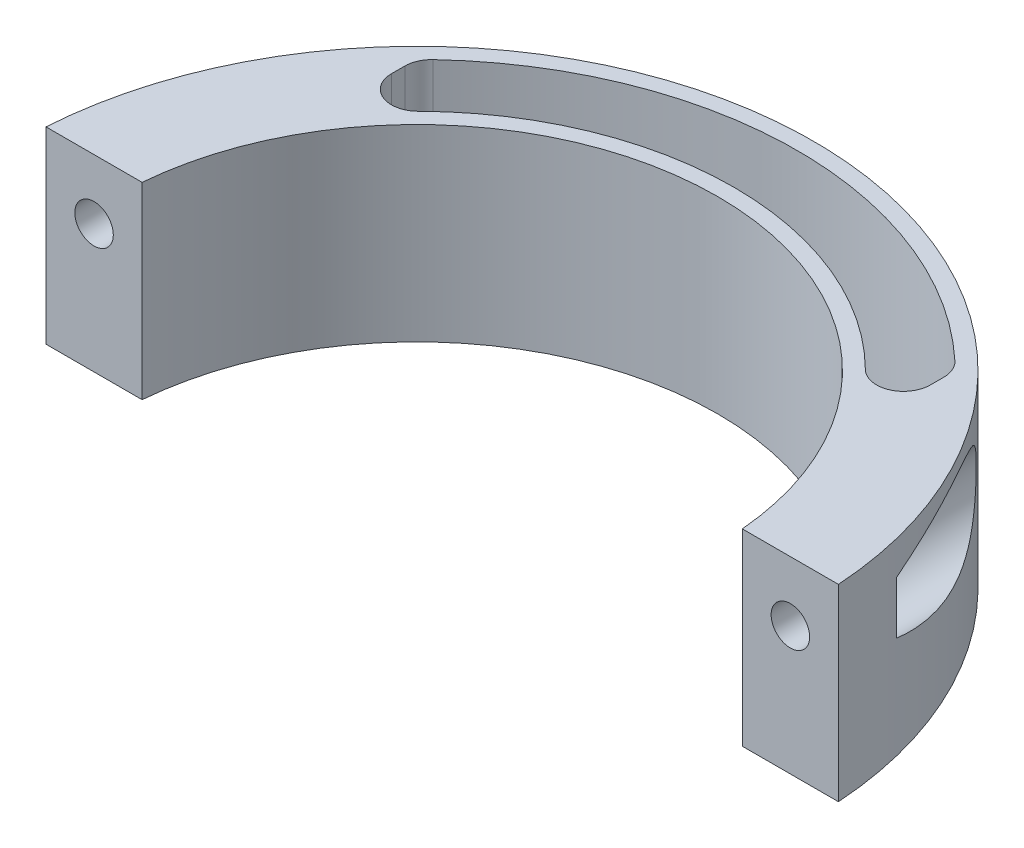
from build123d import *
from build123d.topology import SkipClean

# Parameters (mm, degrees)
SKETCH1_R               = 73.66
SKETCH1_R_2             = 55.88
BOSS_EXTRUDE1_DEPTH     = 22.225
CUT_EXTRUDE1_REACH      = 108.515
SKETCH3_W               = 174.179431321
SKETCH3_H               = 95.128766337
F_1_4_CLEARANCE_HOLE1_D = 7.14248
SKETCH5_R               = 8.5
CUT_EXTRUDE2_DEPTH      = 56.1975
BOSS_EXTRUDE3_START     = 12.7
BOSS_EXTRUDE3_DEPTH     = 12.7
CUT_EXTRUDE3_DEPTH      = 31.925
FILLET1_R               = 5


with BuildPart() as part:
    # Sketch1 → Boss-Extrude1 (new body)
    with BuildSketch(Plane(origin=(0, 0, 0), x_dir=(1, 0, 0), z_dir=(0, 1, 0))):
        with Locations(Location((0, 0, 0), (0, 0, 270))):
            Circle(SKETCH1_R)
        with Locations(Location((0, 0, 0), (0, 0, 270))):
            Circle(SKETCH1_R_2, mode=Mode.SUBTRACT)
    extrude(amount=BOSS_EXTRUDE1_DEPTH)

    # Sketch3 → Cut-Extrude1 (cut, up to next)
    with BuildSketch(Plane(origin=(0, 22.225, 0), x_dir=(1, 0, 0), z_dir=(0, 1, 0)), mode=Mode.PRIVATE) as cut_extrude1_sk1:
        with Locations((-0.022555156, -42.801883168)):
            Rectangle(SKETCH3_W, SKETCH3_H)
    cut_extrude1_tool1 = extrude(cut_extrude1_sk1.sketch, amount=-CUT_EXTRUDE1_REACH, mode=Mode.PRIVATE) & part.part
    add(cut_extrude1_tool1.solids().sort_by_distance((-0.022555, 22.225, 42.801883))[0], mode=Mode.SUBTRACT)

    # 1/4 Clearance Hole1 (through all)
    with Locations(Plane(origin=(-64.591280655, 11.1125, -4.7625), x_dir=(1, 0, 0), z_dir=(0, 0, 1))):
        with Locations((0, 0), (129.18256131, 0)):
            Hole(F_1_4_CLEARANCE_HOLE1_D / 2)

    # Sketch5 → Cut-Extrude2 (cut)
    with BuildSketch(Plane(origin=(0, 0, -73.66), x_dir=(-1, 0, 0), z_dir=(0, 0, -1))):
        with Locations((-64.591280655, 11.1125)):
            Circle(SKETCH5_R)
        with Locations((64.591280655, 11.1125)):
            Circle(SKETCH5_R)
    extrude(amount=-CUT_EXTRUDE2_DEPTH, mode=Mode.SUBTRACT)

    # Sketch7 → Boss-Extrude3 (add)
    with SkipClean():  # the faces are left unmerged after this step: merging them gives an invalid solid
        with BuildSketch(Plane.XZ.offset(BOSS_EXTRUDE3_START)):
            with BuildLine():
                Line((73.505878634, -4.7625), (55.676682676, -4.7625))
                ThreePointArc((55.676682676, -4.7625), (0, -55.88), (-55.676682676, -4.7625))
                Line((-55.676682676, -4.7625), (-73.505878634, -4.7625))
                ThreePointArc((-73.505878634, -4.7625), (0, -73.66), (73.505878634, -4.7625))
            make_face()
        extrude(amount=-BOSS_EXTRUDE3_DEPTH)

    # Sketch9 → Cut-Extrude3 (cut)
    with SkipClean():  # the faces are left unmerged after this step: merging them gives an invalid solid
        with BuildSketch(Plane(origin=(0, 22.225, 0), x_dir=(1, 0, 0), z_dir=(0, 1, 0))):
            with BuildLine():
                Line((-50, 49.928304598), (-50, 31.094282433))
                ThreePointArc((-50, 31.094282433), (0, 58.88), (50, 31.094282433))
                Line((50, 31.094282433), (50, 49.928304598))
                ThreePointArc((50, 49.928304598), (0, 70.66), (-50, 49.928304598))
            make_face()
        extrude(amount=-CUT_EXTRUDE3_DEPTH, mode=Mode.SUBTRACT)

    # Fillet1
    fillet1_edges = [part.edges().sort_by_distance(p)[0] for p in [
        (-50, 6.2625, -31.094282433),
        (50, 6.2625, -31.094282433),
        (50, 6.2625, -49.928304598),
        (-50, 6.2625, -49.928304598),
    ]]
    fillet(fillet1_edges, radius=FILLET1_R)


solid = part.part
